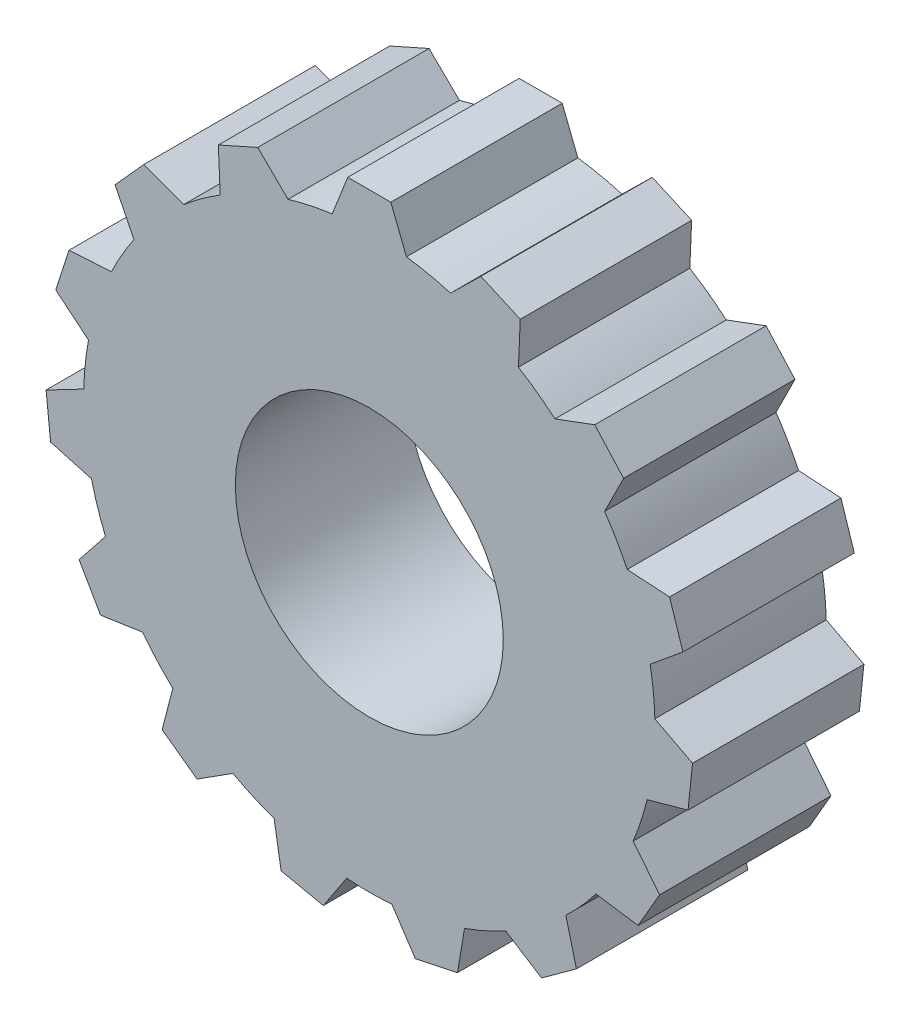
from build123d import *

# Parameters (mm, degrees)
BOSS_EXTRUDE1_DEPTH = 30
SKETCH2_R           = 23.45019305
CUT_EXTRUDE1_DEPTH  = 30


with BuildPart() as part:
    # Sketch1 → Boss-Extrude1 (new body)
    with BuildSketch(Plane.XY):
        with BuildLine():
            Line((6.50170184, 49.57547653), (3.772289399, 56.49452457))
            Line((3.772289399, 56.49452457), (-3.772289399, 56.49452457))
            Line((-3.772289399, 56.49452457), (-6.50170184, 49.57547653))
            ThreePointArc((-6.50170184, 49.57547653), (-10.395584541, 48.907380037), (-14.22456272, 47.933931775))
            Line((-14.22456272, 47.933931775), (-19.532235431, 53.144644629))
            Line((-19.532235431, 53.144644629), (-26.424551121, 50.075987976))
            Line((-26.424551121, 50.075987976), (-26.103763086, 42.644971014))
            ThreePointArc((-26.103763086, 42.644971014), (-29.389262615, 40.450849719), (-32.491271159, 38.00417475))
            Line((-32.491271159, 38.00417475), (-39.459459309, 40.605572828))
            Line((-39.459459309, 40.605572828), (-44.507767895, 34.998858134))
            Line((-44.507767895, 34.998858134), (-41.192246548, 28.340762592))
            ThreePointArc((-41.192246548, 28.340762592), (-43.301270189, 25), (-45.139943641, 21.503150654))
            Line((-45.139943641, 21.503150654), (-52.563784195, 21.045428595))
            Line((-52.563784195, 21.045428595), (-54.895187259, 13.870107767))
            Line((-54.895187259, 13.870107767), (-49.158216363, 9.13617885))
            ThreePointArc((-49.158216363, 9.13617885), (-49.726094768, 5.226423163), (-49.983509784, 1.28403646))
            Line((-49.983509784, 1.28403646), (-56.579353267, -2.153661434))
            Line((-56.579353267, -2.153661434), (-55.790730039, -9.656910239))
            Line((-55.790730039, -9.656910239), (-48.624283981, -11.648133214))
            ThreePointArc((-48.624283981, -11.648133214), (-47.552825815, -15.450849719), (-46.184473, -19.157099304))
            Line((-46.184473, -19.157099304), (-50.811838152, -24.980363835))
            Line((-50.811838152, -24.980363835), (-47.039548753, -31.514160735))
            Line((-47.039548753, -31.514160735), (-39.68277116, -30.418377226))
            ThreePointArc((-39.68277116, -30.418377226), (-37.157241274, -33.456530318), (-34.399721261, -36.285798561))
            Line((-34.399721261, -36.285798561), (-36.258494609, -43.48773439))
            Line((-36.258494609, -43.48773439), (-30.154802146, -47.922326542))
            Line((-30.154802146, -47.922326542), (-23.879746699, -43.929007473))
            ThreePointArc((-23.879746699, -43.929007473), (-20.336832154, -45.677272882), (-16.666945204, -47.1403536))
            Line((-16.666945204, -47.1403536), (-15.43572795, -54.475680595))
            Line((-15.43572795, -54.475680595), (-8.0560163, -56.04428673))
            Line((-8.0560163, -56.04428673), (-3.947697093, -49.843913246))
            ThreePointArc((-3.947697093, -49.843913246), (0, -50), (3.947697093, -49.843913246))
            Line((3.947697093, -49.843913246), (8.056016301, -56.04428673))
            Line((8.056016301, -56.04428673), (15.43572795, -54.475680595))
            Line((15.43572795, -54.475680595), (16.666945204, -47.1403536))
            ThreePointArc((16.666945204, -47.1403536), (20.336832154, -45.677272882), (23.879746699, -43.929007473))
            Line((23.879746699, -43.929007473), (30.154802146, -47.922326542))
            Line((30.154802146, -47.922326542), (36.258494609, -43.48773439))
            Line((36.258494609, -43.48773439), (34.399721261, -36.285798561))
            ThreePointArc((34.399721261, -36.285798561), (37.157241274, -33.456530318), (39.68277116, -30.418377226))
            Line((39.68277116, -30.418377226), (47.039548753, -31.514160735))
            Line((47.039548753, -31.514160735), (50.811838152, -24.980363835))
            Line((50.811838152, -24.980363835), (46.184473, -19.157099304))
            ThreePointArc((46.184473, -19.157099304), (47.552825815, -15.450849719), (48.624283981, -11.648133214))
            Line((48.624283981, -11.648133214), (55.790730039, -9.656910239))
            Line((55.790730039, -9.656910239), (56.579353267, -2.153661433))
            Line((56.579353267, -2.153661433), (49.983509784, 1.28403646))
            ThreePointArc((49.983509784, 1.28403646), (49.726094768, 5.226423163), (49.158216363, 9.13617885))
            Line((49.158216363, 9.13617885), (54.895187259, 13.870107767))
            Line((54.895187259, 13.870107767), (52.563784195, 21.045428595))
            Line((52.563784195, 21.045428595), (45.139943641, 21.503150654))
            ThreePointArc((45.139943641, 21.503150654), (43.301270189, 25), (41.192246548, 28.340762592))
            Line((41.192246548, 28.340762592), (44.507767895, 34.998858134))
            Line((44.507767895, 34.998858134), (39.459459309, 40.605572828))
            Line((39.459459309, 40.605572828), (32.491271159, 38.00417475))
            ThreePointArc((32.491271159, 38.00417475), (29.389262615, 40.450849719), (26.103763086, 42.644971014))
            Line((26.103763086, 42.644971014), (26.424551121, 50.075987976))
            Line((26.424551121, 50.075987976), (19.53223543, 53.144644629))
            Line((19.53223543, 53.144644629), (14.22456272, 47.933931775))
            ThreePointArc((14.22456272, 47.933931775), (10.395584541, 48.907380037), (6.50170184, 49.57547653))
        make_face()
    extrude(amount=BOSS_EXTRUDE1_DEPTH)

    # Sketch2 → Cut-Extrude1 (cut)
    with BuildSketch(Plane.XY.offset(30)):
        Circle(SKETCH2_R)
    extrude(amount=-CUT_EXTRUDE1_DEPTH, mode=Mode.SUBTRACT)


solid = part.part
